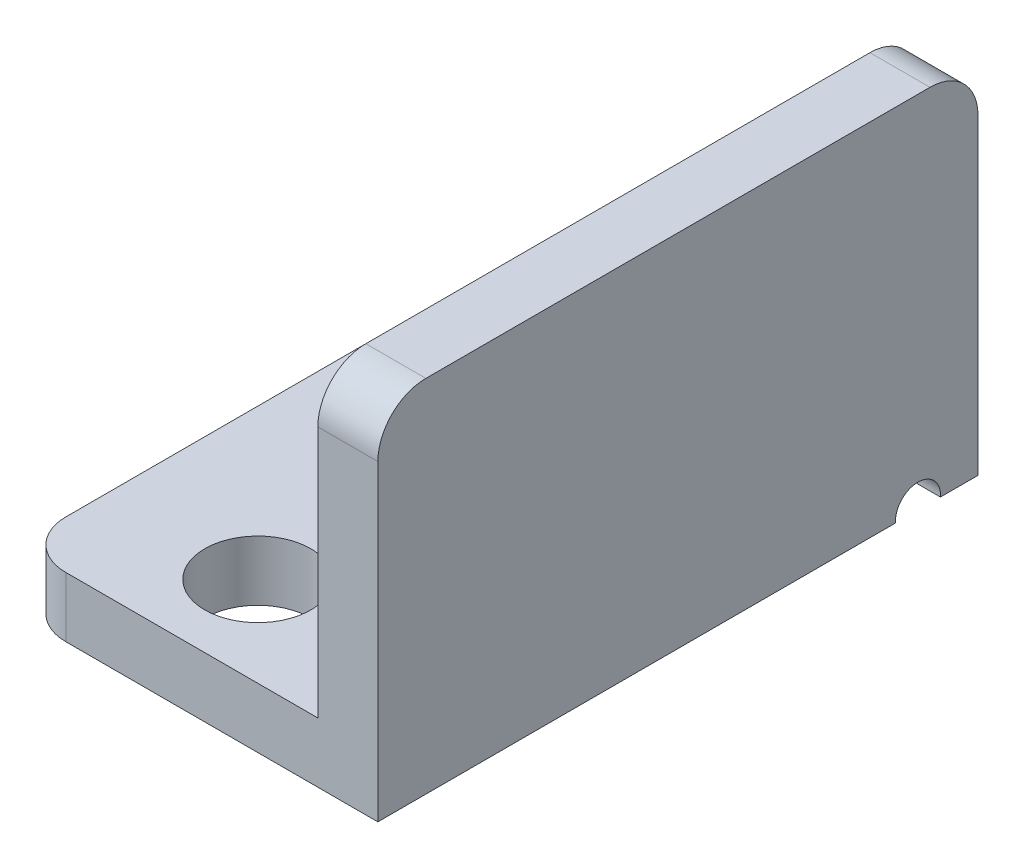
from build123d import *

# Parameters (mm, degrees)
BOSS_EXTRUDE1_DEPTH                 = 31.75
F_3_32_0_09375_DIAMETER_HOLE1_D     = 2.38125
F_3_32_0_09375_DIAMETER_HOLE1_DEPTH = 25.4
F_3_32_0_09375_DIAMETER_HOLE1_TIP   = 0.715399675
F_10_CLEARANCE_HOLE1_D              = 5.6134
F_10_CLEARANCE_HOLE1_DEPTH          = 25.4
F_10_CLEARANCE_HOLE1_TIP            = 1.686435499
FILLET1_R                           = 2.54


with BuildPart() as part:
    # Sketch1 → Boss-Extrude1 (new body)
    with BuildSketch(Plane.XY):
        Polygon((0, 0), (0, 19.05), (-3.175, 19.05), (-3.175, 3.175), (-19.05, 3.175), (-19.05, 0), align=None)
    extrude(amount=BOSS_EXTRUDE1_DEPTH)

    # 3/32 (0.09375) Diameter Hole1
    with Locations(Plane(origin=(0, 0, 0), x_dir=(0, 0, -1), z_dir=(1, 0, 0))):
        with Locations((-3.175, 0.0889)):
            Hole(F_3_32_0_09375_DIAMETER_HOLE1_D / 2, depth=F_3_32_0_09375_DIAMETER_HOLE1_DEPTH)
            with Locations((0, 0, -(F_3_32_0_09375_DIAMETER_HOLE1_DEPTH + F_3_32_0_09375_DIAMETER_HOLE1_TIP / 2))):  # 118° drill point
                Cone(0, F_3_32_0_09375_DIAMETER_HOLE1_D / 2, F_3_32_0_09375_DIAMETER_HOLE1_TIP, mode=Mode.SUBTRACT)

    # #10 Clearance Hole1
    with Locations(Plane(origin=(0, 3.175, 0), x_dir=(1, 0, 0), z_dir=(0, 1, 0))):
        with Locations((-11.1125, -26.9875), (-11.1125, -4.7625)):
            Hole(F_10_CLEARANCE_HOLE1_D / 2, depth=F_10_CLEARANCE_HOLE1_DEPTH)
            with Locations((0, 0, -(F_10_CLEARANCE_HOLE1_DEPTH + F_10_CLEARANCE_HOLE1_TIP / 2))):  # 118° drill point
                Cone(0, F_10_CLEARANCE_HOLE1_D / 2, F_10_CLEARANCE_HOLE1_TIP, mode=Mode.SUBTRACT)

    # Fillet1
    fillet1_edges = [part.edges().sort_by_distance(p)[0] for p in [
        (-1.5875, 19.05, 31.75),
        (-19.05, 1.5875, 31.75),
        (-19.05, 1.5875, 0),
        (-1.5875, 19.05, 0),
    ]]
    fillet(fillet1_edges, radius=FILLET1_R)


solid = part.part
